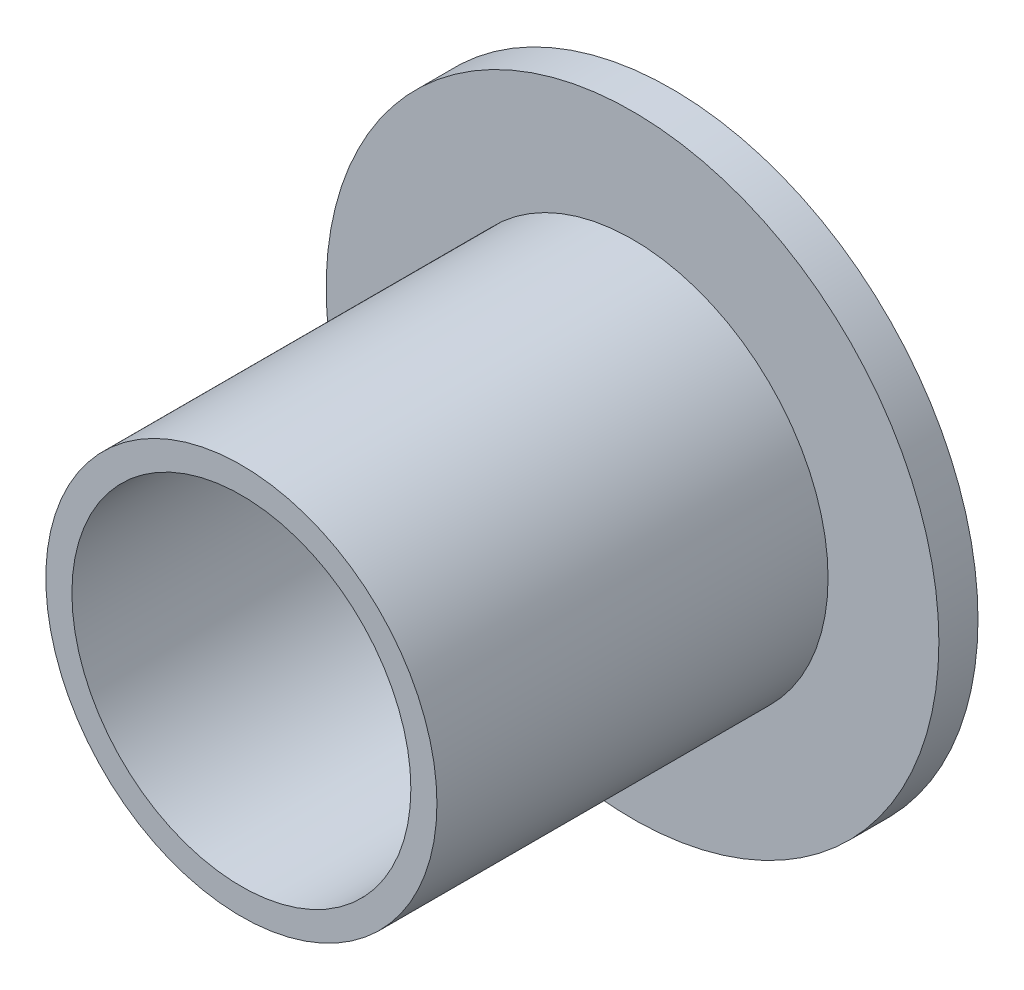
from build123d import *

# Parameters (mm, degrees)
SKETCH1_R           = 23.5
BOSS_EXTRUDE1_DEPTH = 3
SKETCH2_R           = 15
BOSS_EXTRUDE2_DEPTH = 30
SKETCH3_R           = 13
CUT_EXTRUDE1_DEPTH  = 47.834816109


with BuildPart() as part:
    # Sketch1 → Boss-Extrude1 (new body)
    with BuildSketch(Plane.XY):
        Circle(SKETCH1_R)
    extrude(amount=BOSS_EXTRUDE1_DEPTH)

    # Sketch2 → Boss-Extrude2 (add)
    with BuildSketch(Plane.XY.offset(3)):
        Circle(SKETCH2_R)
    extrude(amount=BOSS_EXTRUDE2_DEPTH)

    # Sketch3 → Cut-Extrude1 (cut, through all)
    with BuildSketch(Plane.XY.offset(33)):
        Circle(SKETCH3_R)
    extrude(amount=-CUT_EXTRUDE1_DEPTH, mode=Mode.SUBTRACT)


solid = part.part
